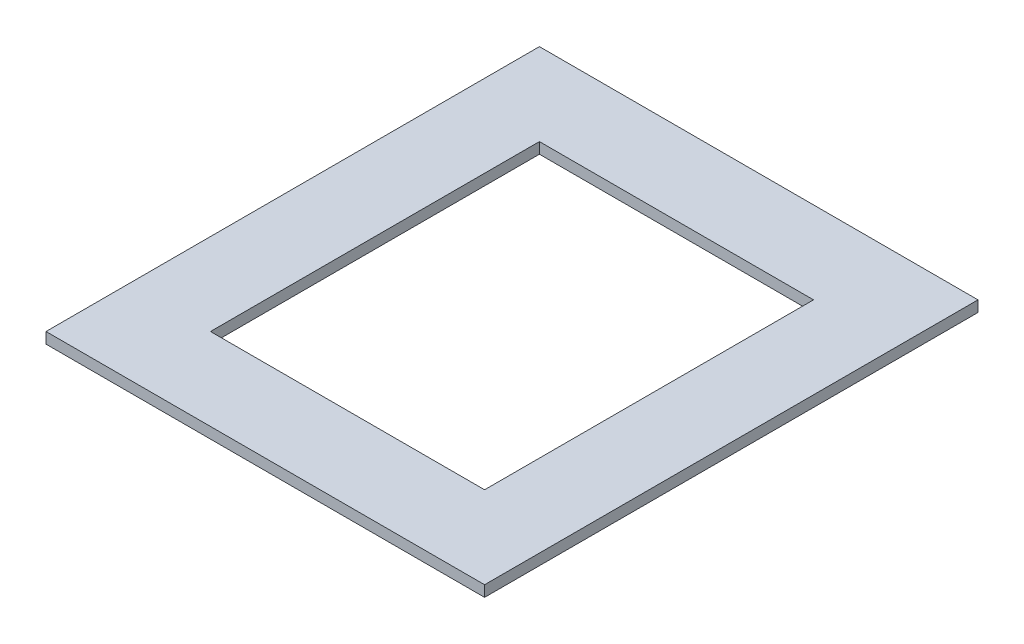
from build123d import *

# Parameters (mm, degrees)
ESQUISSE1_W             = 400
ESQUISSE1_H             = 450
BOSS_EXTRU_1_DEPTH      = 10
ESQUISSE2_W             = 250
ESQUISSE2_H             = 300
ENL_V_MAT_EXTRU_1_DEPTH = 10


with BuildPart() as part:
    # Esquisse1 → Boss.-Extru.1 (new body)
    with BuildSketch(Plane(origin=(0, 0, 0), x_dir=(1, 0, 0), z_dir=(0, 1, 0))):
        with Locations((-200, 225)):
            Rectangle(ESQUISSE1_W, ESQUISSE1_H)
    extrude(amount=BOSS_EXTRU_1_DEPTH)

    # Esquisse2 → Enlèv. mat.-Extru.1 (cut)
    with BuildSketch(Plane(origin=(0, 10, 0), x_dir=(1, 0, 0), z_dir=(0, 1, 0))):
        with Locations((-200, 225)):
            Rectangle(ESQUISSE2_W, ESQUISSE2_H)
    extrude(amount=-ENL_V_MAT_EXTRU_1_DEPTH, mode=Mode.SUBTRACT)


solid = part.part
